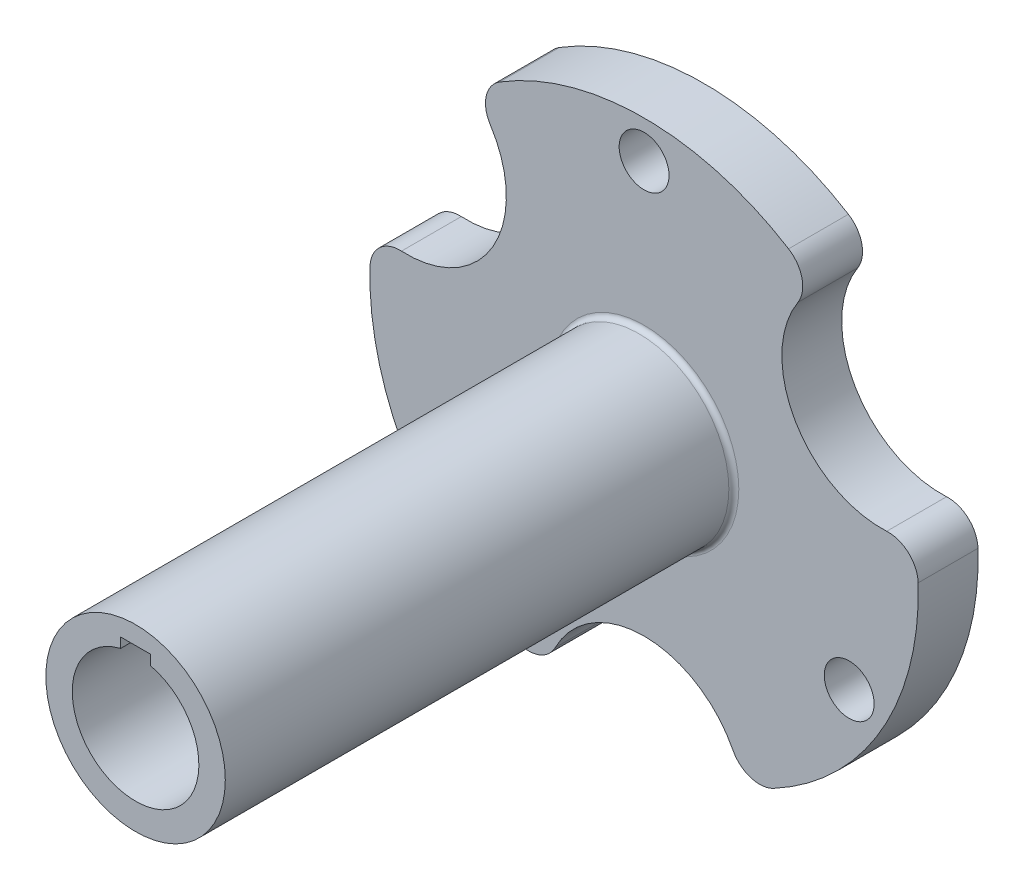
from build123d import *

# Parameters (mm, degrees)
SKETCH1_R           = 2.5
SKETCH1_R_2         = 6.35
BOSS_EXTRUDE1_DEPTH = 6
SKETCH2_R           = 9
SKETCH2_R_2         = 6.35
BOSS_EXTRUDE2_DEPTH = 51
FILLET1_R           = 3
CUT_EXTRUDE1_START  = -45
CUT_EXTRUDE1_DEPTH  = 45
FILLET2_R           = 0.5


with BuildPart() as part:
    # Sketch1 → Boss-Extrude1 (new body)
    with BuildSketch(Plane.XY):
        with BuildLine():
            ThreePointArc((17.324446131, 21.356815452), (0, 27.5), (-17.324446131, 21.356815452))
            ThreePointArc((-17.324446131, 21.356815452), (-15.155444566, 8.75), (-27.157767791, 4.325002729))
            ThreePointArc((-27.157767791, 4.325002729), (-23.815698604, -13.75), (-9.83332166, -25.681818182))
            ThreePointArc((-9.83332166, -25.681818182), (0, -17.5), (9.83332166, -25.681818182))
            ThreePointArc((9.83332166, -25.681818182), (23.815698604, -13.75), (27.157767791, 4.325002729))
            ThreePointArc((27.157767791, 4.325002729), (15.155444566, 8.75), (17.324446131, 21.356815452))
        make_face()
        with Locations((0, 23.75)):
            Circle(SKETCH1_R, mode=Mode.SUBTRACT)
        with Locations((-20.56810334, -11.875)):
            Circle(SKETCH1_R, mode=Mode.SUBTRACT)
        with Locations((20.56810334, -11.875)):
            Circle(SKETCH1_R, mode=Mode.SUBTRACT)
        Circle(SKETCH1_R_2, mode=Mode.SUBTRACT)
    extrude(amount=BOSS_EXTRUDE1_DEPTH)

    # Sketch2 → Boss-Extrude2 (add)
    with BuildSketch(Plane.XY.offset(6)):
        Circle(SKETCH2_R)
        Circle(SKETCH2_R_2, mode=Mode.SUBTRACT)
    extrude(amount=BOSS_EXTRUDE2_DEPTH)

    # Fillet1
    fillet1_edges = [part.edges().sort_by_distance(p)[0] for p in [
        (27.157767791, 4.325002729, 3),
        (9.83332166, -25.681818182, 3),
        (-9.83332166, -25.681818182, 3),
        (-27.157767791, 4.325002729, 3),
        (-17.324446131, 21.356815452, 3),
        (17.324446131, 21.356815452, 3),
    ]]
    fillet(fillet1_edges, radius=FILLET1_R)

    # Sketch3 → Cut-Extrude1 (cut)
    with BuildSketch(Plane.XY.offset(57).offset(CUT_EXTRUDE1_START)):
        with BuildLine():
            Line((-1.5, 6.170291727), (-1.5, 7.170291727))
            Line((-1.5, 7.170291727), (1.5, 7.170291727))
            Line((1.5, 7.170291727), (1.5, 6.170291727))
            ThreePointArc((1.5, 6.170291727), (0, 6.35), (-1.5, 6.170291727))
        make_face()
    extrude(amount=CUT_EXTRUDE1_DEPTH, mode=Mode.SUBTRACT)

    # Fillet2
    fillet2_edges = [part.edges().sort_by_distance(p)[0] for p in [
        (-9, 0, 6),
    ]]
    fillet(fillet2_edges, radius=FILLET2_R)


solid = part.part
